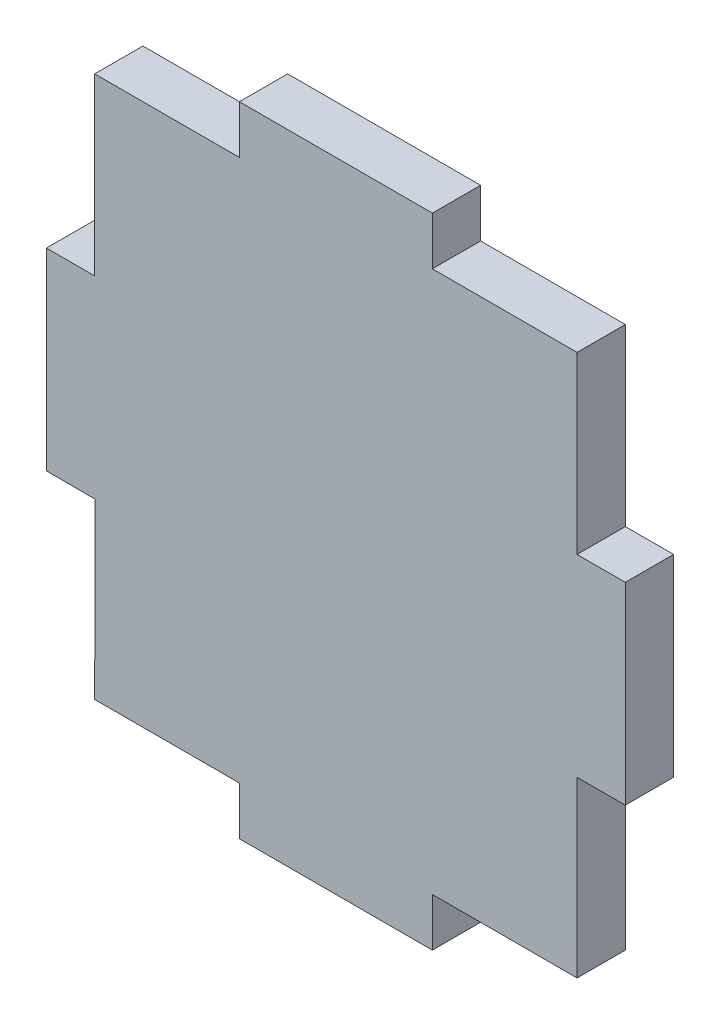
from build123d import *

# Parameters (mm, degrees)
BOSS_EXTRUDE1_DEPTH = 2.5


with BuildPart() as part:
    # Sketch2 → Boss-Extrude1 (new, symmetric)
    with BuildSketch(Plane.XY):
        Polygon((838.735533319, -92.57415942), (838.747024458, -87.57415942), (858.747024458, -87.57415942), (858.747024458, -92.57415942), (873.747024458, -92.57415942), (873.747024458, -110.71105012), (878.747024458, -110.71105012), (878.747024458, -130.71105012), (873.747037663, -130.722541229), (873.747024458, -148.729086599), (858.747024458, -148.729086599), (858.747024458, -153.729086599), (838.747024458, -153.729086599), (838.73553338, -148.729113008), (823.747024458, -148.729086599), (823.788794943, -130.722745845), (818.747024458, -130.71105012), (818.747024458, -110.71105012), (823.747024458, -110.71105012), (823.747024458, -92.57415942), align=None)
    extrude(amount=BOSS_EXTRUDE1_DEPTH, both=True)


solid = part.part
